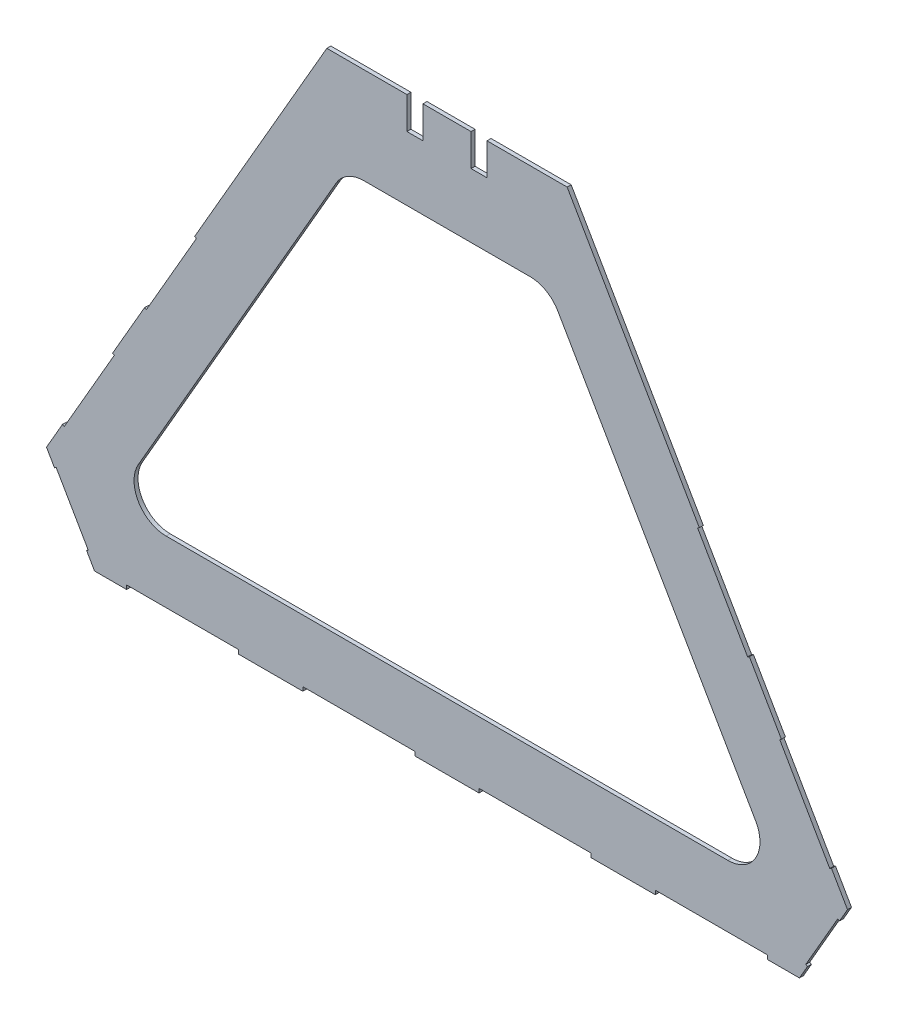
from build123d import *

# Parameters (mm, degrees)
BOSS_EXTRUDE1_DEPTH = 3.175
SKETCH2_W           = 12.7
SKETCH2_H           = 25.4
CUT_EXTRUDE1_DEPTH  = 612.325617511
SKETCH4_W           = 88.9
SKETCH4_H           = 3.175
CUT_EXTRUDE2_DEPTH  = 612.325617511
CUT_EXTRUDE3_DEPTH  = 612.325617511


with BuildPart() as part:
    # Sketch1 → Boss-Extrude1 (new body)
    with BuildSketch(Plane.XY):
        Polygon((0, 0), (190.5, 0), (412.75, -384.948291982), (374.65, -450.939427751), (-184.15, -450.939427751), (-222.25, -384.948291982), align=None)
    extrude(amount=BOSS_EXTRUDE1_DEPTH)

    # Sketch2 → Cut-Extrude1 (cut, through all)
    with BuildSketch(Plane.XY.offset(3.175)):
        with Locations((69.85, -12.7)):
            Rectangle(SKETCH2_W, SKETCH2_H)
        with BuildLine():
            Line((29.329393675, -76.2), (161.170606325, -76.2))
            ThreePointArc((161.170606325, -76.2), (173.870606325, -79.602954744), (183.167651581, -88.9))
            Line((183.167651581, -88.9), (339.952954744, -360.460110958))
            ThreePointArc((339.952954744, -360.460110958), (339.952954744, -385.860110958), (317.955909488, -398.560110958))
            Line((317.955909488, -398.560110958), (-127.455909488, -398.560110958))
            ThreePointArc((-127.455909488, -398.560110958), (-149.452954744, -385.860110958), (-149.452954744, -360.460110958))
            Line((-149.452954744, -360.460110958), (7.332348419, -88.9))
            ThreePointArc((7.332348419, -88.9), (16.629393675, -79.602954744), (29.329393675, -76.2))
        make_face()
        with Locations((120.65, -12.7)):
            Rectangle(SKETCH2_W, SKETCH2_H)
    extrude(amount=-CUT_EXTRUDE1_DEPTH, mode=Mode.SUBTRACT)

    # Sketch4 → Cut-Extrude2 (cut, through all)
    with BuildSketch(Plane.XY.offset(3.175)):
        with Locations((-114.3, -449.351927751)):
            Rectangle(SKETCH4_W, SKETCH4_H)
        with Locations((25.4, -449.351927751)):
            Rectangle(SKETCH4_W, SKETCH4_H)
        with Locations((165.1, -449.351927751)):
            Rectangle(SKETCH4_W, SKETCH4_H)
        with Locations((304.8, -449.351927751)):
            Rectangle(SKETCH4_W, SKETCH4_H)
        Polygon((-215.9, -395.94681461), (-214.525184671, -395.15306461), (-189.125184671, -439.147155122), (-190.5, -439.940905122), align=None)
        Polygon((406.4, -395.94681461), (405.025184671, -395.15306461), (379.625184671, -439.147155122), (381, -439.940905122), align=None)
    extrude(amount=-CUT_EXTRUDE2_DEPTH, mode=Mode.SUBTRACT)

    # Sketch5 → Cut-Extrude3 (cut, through all)
    with BuildSketch(Plane.XY.offset(3.175)):
        Polygon((-209.55, -362.951246726), (-208.175184671, -363.744996726), (-168.487684671, -295.004230301), (-169.8625, -294.210480301), align=None)
        Polygon((-143.087684671, -251.010139788), (-103.400184671, -182.269373363), (-104.775, -181.475623363), (-144.4625, -250.216389788), align=None)
        Polygon((400.05, -362.951246726), (398.675184671, -363.744996726), (358.987684671, -295.004230301), (360.3625, -294.210480301), align=None)
        Polygon((334.9625, -250.216389788), (333.587684671, -251.010139788), (293.900184671, -182.269373363), (295.275, -181.475623363), align=None)
    extrude(amount=-CUT_EXTRUDE3_DEPTH, mode=Mode.SUBTRACT)


solid = part.part
